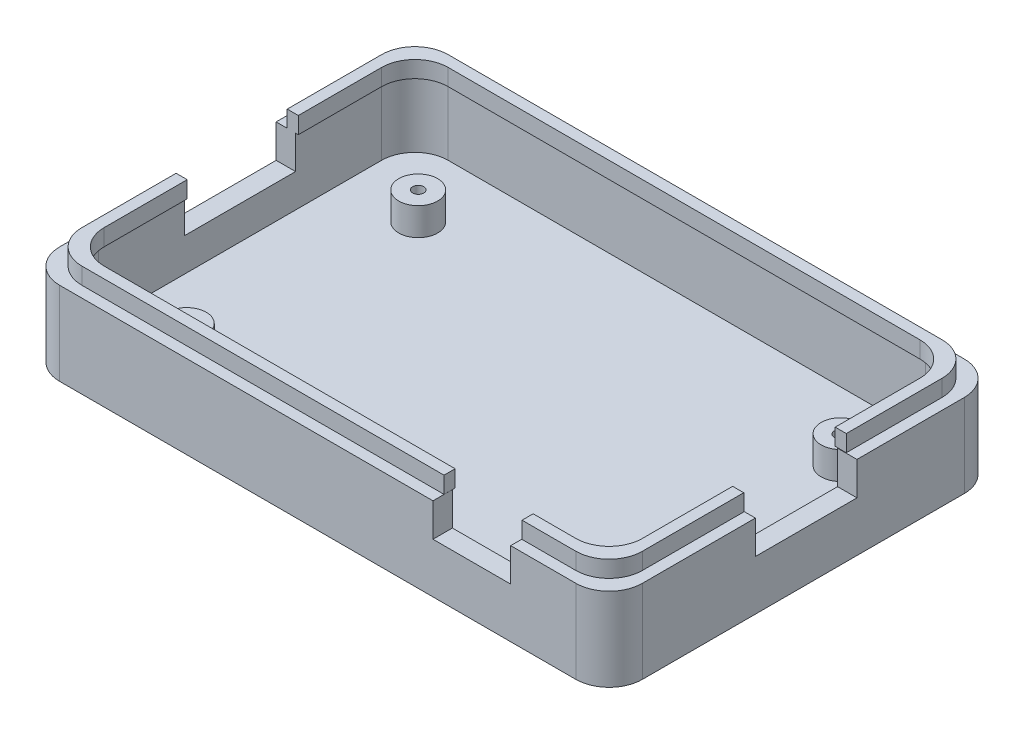
from build123d import *

# Parameters (mm, degrees)
SKETCH1_W           = 105
SKETCH1_H           = 70
BOSS_EXTRUDE1_DEPTH = 15
SKETCH3_W           = 98
SKETCH3_H           = 63
CUT_EXTRUDE1_DEPTH  = 12
FILLET1_R           = 6
SKETCH4_R           = 3.5
BOSS_EXTRUDE2_DEPTH = 5
SKETCH5_R           = 1
CUT_EXTRUDE2_DEPTH  = 8
SKETCH6_W           = 3.5
SKETCH6_H           = 18.3
SKETCH6_W_2         = 14
SKETCH6_H_2         = 3.5
SKETCH6_H_3         = 20
CUT_EXTRUDE3_DEPTH  = 6
BOSS_EXTRUDE3_DEPTH = 3


with BuildPart() as part:
    # Sketch1 → Boss-Extrude1 (new body)
    with BuildSketch(Plane(origin=(0, 0, 0), x_dir=(1, 0, 0), z_dir=(0, 1, 0))):
        Rectangle(SKETCH1_W, SKETCH1_H)
    extrude(amount=BOSS_EXTRUDE1_DEPTH)

    # Sketch3 → Cut-Extrude1 (cut)
    with BuildSketch(Plane(origin=(0, 15, 0), x_dir=(1, 0, 0), z_dir=(0, 1, 0))):
        Rectangle(SKETCH3_W, SKETCH3_H)
    extrude(amount=-CUT_EXTRUDE1_DEPTH, mode=Mode.SUBTRACT)

    # Fillet1
    fillet1_edges = [part.edges().sort_by_distance(p)[0] for p in [
        (-49, 9, 31.5),
        (-49, 9, -31.5),
        (49, 9, -31.5),
        (49, 9, 31.5),
        (52.5, 7.5, 35),
        (-52.5, 7.5, 35),
        (-52.5, 7.5, -35),
        (52.5, 7.5, -35),
    ]]
    fillet(fillet1_edges, radius=FILLET1_R)

    # Sketch4 → Boss-Extrude2 (add)
    with BuildSketch(Plane(origin=(0, 3, 0), x_dir=(1, 0, 0), z_dir=(0, 1, 0))):
        with Locations(Location((40, -22.5, 0), (0, 0, 270))):
            Circle(SKETCH4_R)
        with Locations(Location((40, 19.2, 0), (0, 0, 270))):
            Circle(SKETCH4_R)
        with Locations(Location((-36.1, -22.5, 0), (0, 0, 270))):
            Circle(SKETCH4_R)
        with Locations(Location((-36.1, 19.2, 0), (0, 0, 270))):
            Circle(SKETCH4_R)
    extrude(amount=BOSS_EXTRUDE2_DEPTH)

    # Sketch5 → Cut-Extrude2 (cut)
    with BuildSketch(Plane(origin=(0, 8, 0), x_dir=(1, 0, 0), z_dir=(0, 1, 0))):
        with Locations(Location((-36.1, 19.2, 0), (0, 0, 270))):
            Circle(SKETCH5_R)
        with Locations(Location((-36.1, -22.5, 0), (0, 0, 270))):
            Circle(SKETCH5_R)
        with Locations(Location((40, -22.5, 0), (0, 0, 270))):
            Circle(SKETCH5_R)
        with Locations(Location((40, 19.06026255, 0), (0, 0, 270))):
            Circle(SKETCH5_R)
    extrude(amount=-CUT_EXTRUDE2_DEPTH, mode=Mode.SUBTRACT)

    # Sketch6 → Cut-Extrude3 (cut)
    with BuildSketch(Plane(origin=(0, 15, 0), x_dir=(1, 0, 0), z_dir=(0, 1, 0))):
        with Locations((50.75, 0.51)):
            Rectangle(SKETCH6_W, SKETCH6_H)
        with Locations((27.76, -33.25)):
            Rectangle(SKETCH6_W_2, SKETCH6_H_2)
        with Locations((-50.75, 0)):
            Rectangle(SKETCH6_W, SKETCH6_H_3)
    extrude(amount=-CUT_EXTRUDE3_DEPTH, mode=Mode.SUBTRACT)

    # Sketch7 → Boss-Extrude3 (add)
    with BuildSketch(Plane(origin=(0, 15, 0), x_dir=(1, 0, 0), z_dir=(0, 1, 0))):
        with BuildLine():
            Line((-44.5, 33), (44.5, 33))
            ThreePointArc((44.5, 33), (48.742640687, 31.242640687), (50.5, 27))
            Line((50.5, 27), (50.5, 9.736559035))
            Line((50.5, 9.736559035), (48.5, 9.736559035))
            Line((48.5, 9.736559035), (48.5, 25))
            ThreePointArc((48.5, 25), (46.742640687, 29.242640687), (42.5, 31))
            Line((42.5, 31), (-42.5, 31))
            ThreePointArc((-42.5, 31), (-46.742640687, 29.242640687), (-48.5, 25))
            Line((-48.5, 25), (-48.5, 10))
            Line((-48.5, 10), (-50.5, 10))
            Line((-50.5, 10), (-50.5, 27))
            ThreePointArc((-50.5, 27), (-48.742640687, 31.242640687), (-44.5, 33))
        make_face()
        with BuildLine():
            Line((-44.5, -33), (20.754470261, -33))
            Line((20.754470261, -33), (20.754470261, -31))
            Line((20.754470261, -31), (-42.5, -31))
            ThreePointArc((-42.5, -31), (-46.742640687, -29.242640687), (-48.5, -25))
            Line((-48.5, -25), (-48.5, -10.02702289))
            Line((-48.5, -10.02702289), (-50.5, -10.02702289))
            Line((-50.5, -10.02702289), (-50.5, -27))
            ThreePointArc((-50.5, -27), (-48.742640687, -31.242640687), (-44.5, -33))
        make_face()
        with BuildLine():
            Line((50.5, -8.739580153), (50.5, -27))
            ThreePointArc((50.5, -27), (48.742640687, -31.242640687), (44.5, -33))
            Line((44.5, -33), (34.809182833, -33))
            Line((34.809182833, -33), (34.809182833, -31))
            Line((34.809182833, -31), (42.5, -31))
            ThreePointArc((42.5, -31), (46.742640687, -29.242640687), (48.5, -25))
            Line((48.5, -25), (48.5, -8.739580153))
            Line((48.5, -8.739580153), (50.5, -8.739580153))
        make_face()
    extrude(amount=BOSS_EXTRUDE3_DEPTH)


solid = part.part
